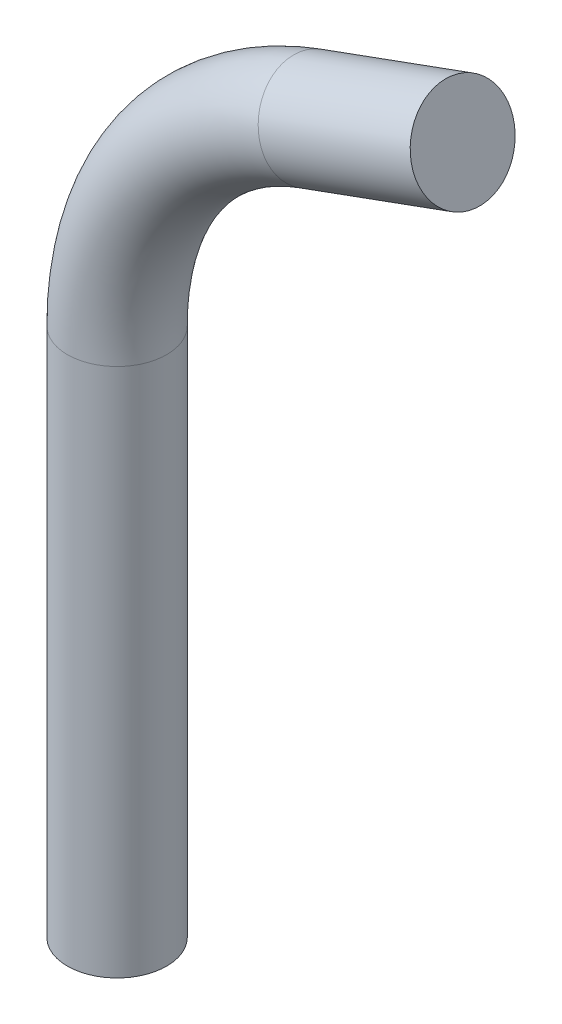
from build123d import *

# Parameters (mm, degrees)
SKETCH2_R = 6.75


with BuildPart() as part:
    # Sweep1: sweep along a path in Sketch1
    with BuildLine(Plane.XY) as sweep1_path:
        Line((0, 0), (0, 71.991698472))
        ThreePointArc((0, 71.991698472), (7.233918228, 94.934755926), (26.319194267, 109.579403303))
        Line((26.319194267, 109.579403303), (46.984631039, 117.101007166))
    # Sketch2 → Sweep1 (sweep)
    with BuildSketch(Plane(origin=(0, 0, 0), x_dir=(1, 0, 0), z_dir=(0, 1, 0))):
        Circle(SKETCH2_R)
    sweep(path=sweep1_path.line)


solid = part.part
